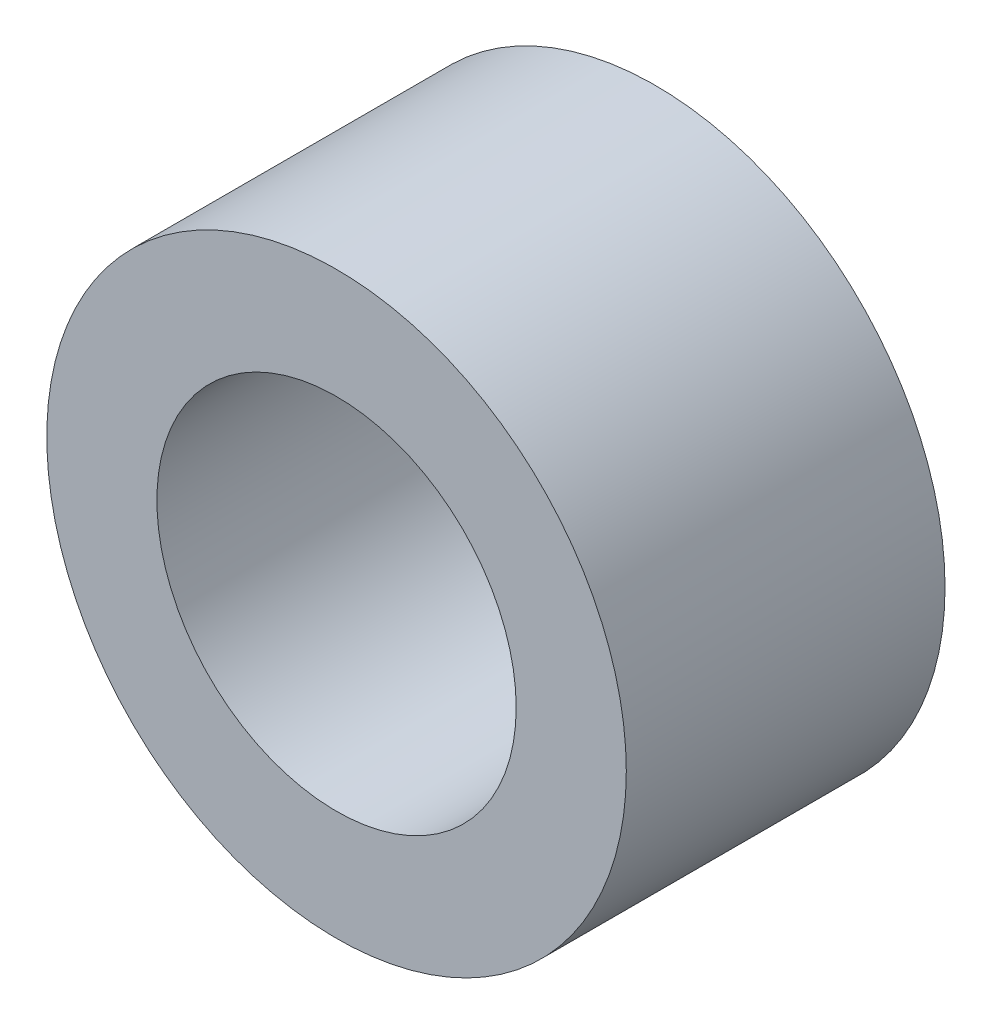
from build123d import *

# Parameters (mm, degrees)
SKETCH_1_R      = 5
SKETCH_1_R_2    = 3.1
EXTRUDE_1_DEPTH = 5.5


with BuildPart() as part:
    # 草图1 → 凸台-拉伸1 (new body)
    with BuildSketch(Plane.XY):
        Circle(SKETCH_1_R)
        Circle(SKETCH_1_R_2, mode=Mode.SUBTRACT)
    extrude(amount=EXTRUDE_1_DEPTH)


solid = part.part
